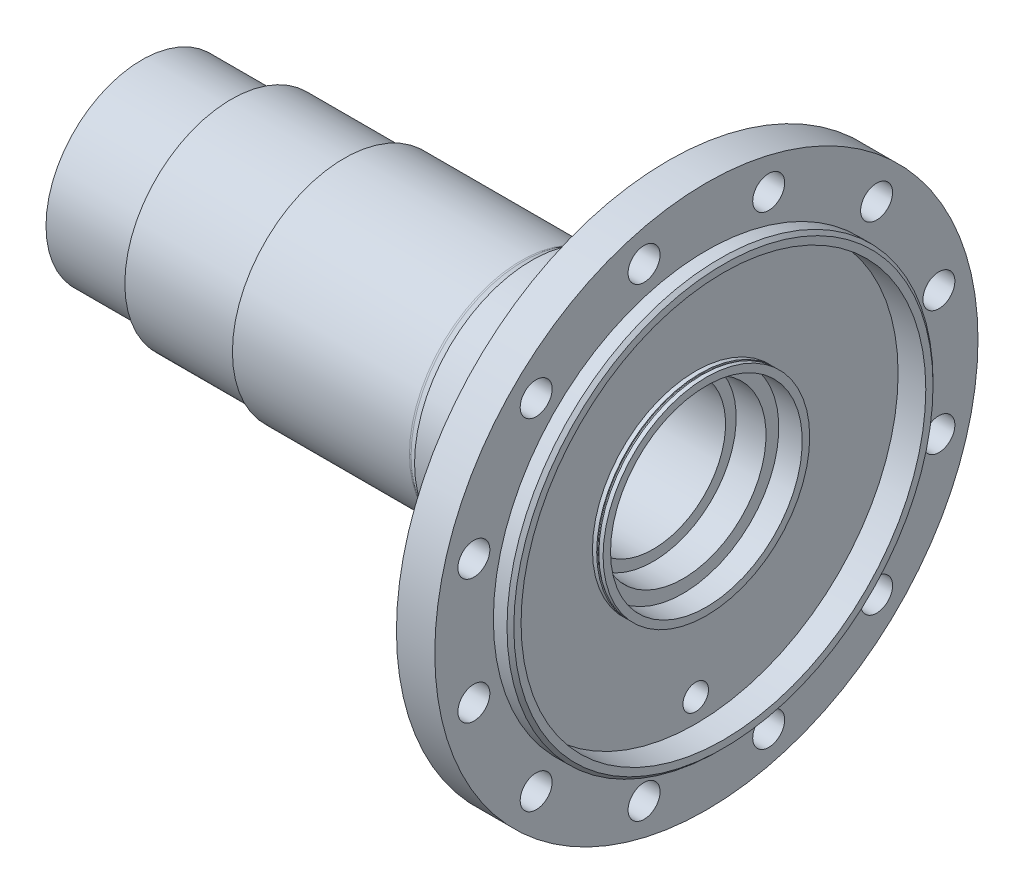
from build123d import *

# Parameters (mm, degrees)
SKETCH_3_W           = 2
SKETCH_3_H           = 46.5
SKETCH_5_W           = 2
SKETCH_5_H           = 46.5
SKETCH_6_R           = 7.5
CUT_EXTRUDE_1_DEPTH  = 328.171973127
SKETCH_7_R           = 7.5
CUT_EXTRUDE_2_DEPTH  = 328.171973127
SKETCH_8_R           = 7.5
CUT_EXTRUDE_3_DEPTH  = 328.171973127
SKETCH_9_R           = 7.5
CUT_EXTRUDE_4_DEPTH  = 328.171973127
SKETCH_10_R          = 7.5
CUT_EXTRUDE_5_DEPTH  = 328.171973127
SKETCH_11_R          = 7.5
CUT_EXTRUDE_6_DEPTH  = 328.171973127
SKETCH_12_R          = 7.5
CUT_EXTRUDE_7_DEPTH  = 328.171973127
SKETCH_13_R          = 7.5
CUT_EXTRUDE_8_DEPTH  = 328.171973127
SKETCH_14_R          = 7.5
CUT_EXTRUDE_9_DEPTH  = 328.171973127
SKETCH_15_R          = 7.5
CUT_EXTRUDE_10_DEPTH = 328.171973127
SKETCH_16_R          = 7.5
CUT_EXTRUDE_11_DEPTH = 328.171973127
SKETCH_17_R          = 7.5
CUT_EXTRUDE_12_DEPTH = 328.171973127
SKETCH_18_R          = 6
CUT_EXTRUDE_13_DEPTH = 328.171973127


with BuildPart() as part:
    # Эскиз1 → Повернуть1 (revolve)
    with BuildSketch(Plane.XY, mode=Mode.PRIVATE) as revolve_1_sk:
        with BuildLine():
            Line((0, 0), (273, 0))
            Line((273, 0), (273, 98.4))
            Line((273, 98.4), (271.4, 100))
            Line((271.4, 100), (265, 100))
            Line((265, 100), (265, 127.5))
            Line((265, 127.5), (247, 127.5))
            Line((247, 127.5), (247, 94.828427125))
            ThreePointArc((247, 94.828427125), (246.847759065, 94.06306026), (246.414213562, 93.414213562))
            Line((246.414213562, 93.414213562), (245, 92))
            Line((245, 92), (245, 82.828427125))
            ThreePointArc((245, 82.828427125), (244.847759065, 82.06306026), (244.414213562, 81.414213562))
            Line((244.414213562, 81.414213562), (241, 78))
            Line((241, 78), (241, 68.328427125))
            ThreePointArc((241, 68.328427125), (240.847759065, 67.56306026), (240.414213562, 66.914213562))
            Line((240.414213562, 66.914213562), (239, 65.5))
            Line((239, 65.5), (239, 64.5))
            ThreePointArc((239, 64.5), (238.414213562, 63.085786438), (237, 62.5))
            Line((237, 62.5), (218, 62.5))
            Line((218, 62.5), (215, 60.767949192))
            Line((215, 60.767949192), (215, 57))
            ThreePointArc((215, 57), (214.414213562, 55.585786438), (213, 55))
            Line((213, 55), (183, 55))
            Line((183, 55), (179.133974596, 52.767949192))
            ThreePointArc((179.133974596, 52.767949192), (178.651612686, 52.568148347), (178.133974596, 52.5))
            Line((178.133974596, 52.5), (95, 52.5))
            Line((95, 52.5), (95, 50))
            Line((95, 50), (42, 50))
            Line((42, 50), (42, 45))
            Line((42, 45), (0, 45))
            Line((0, 45), (0, 0))
        make_face()
    revolve(revolve_1_sk.sketch.rotate(Axis((0, 0, 0), (1, 0, 0)), 90), axis=Axis((0, 0, 0), (1, 0, 0)))

    # Эскиз2 → Вырез-Повернуть1 (revolve, cut)
    with BuildSketch(Plane.XY, mode=Mode.PRIVATE) as cut_revolve_1_sk:
        Polygon((0, 0), (273, 0), (273, 95), (265, 95), (265, 45), (254, 45), (254, 39), (240, 39), (240, 34), (203.5, 34), (203.5, 31), (3, 31), (0, 32.732050808), align=None)
    revolve(cut_revolve_1_sk.sketch.rotate(Axis((0, 0, 0), (1, 0, 0)), 90), axis=Axis((0, 0, 0), (1, 0, 0)), mode=Mode.SUBTRACT)

    # Эскиз3 → Rear_recess_left (revolve, cut)
    with BuildSketch(Plane.XY, mode=Mode.PRIVATE) as rear_recess_left_sk:
        with Locations((261, 71.75)):
            Rectangle(SKETCH_3_W, SKETCH_3_H)
    revolve(rear_recess_left_sk.sketch.rotate(Axis((0, 0, 0), (1, 0, 0)), 90), axis=Axis((0, 0, 0), (1, 0, 0)), mode=Mode.SUBTRACT)

    # Эскиз4 → Collar_groove_nominal (revolve, cut)
    with BuildSketch(Plane.XY, mode=Mode.PRIVATE) as collar_groove_nominal_sk:
        with BuildLine():
            Line((263, 48), (263, 95))
            Line((263, 95), (262, 95))
            Line((262, 95), (262, 48))
            ThreePointArc((262, 48), (262.146446609, 47.646446609), (262.5, 47.5))
            ThreePointArc((262.5, 47.5), (262.853553391, 47.646446609), (263, 48))
        make_face()
    revolve(collar_groove_nominal_sk.sketch.rotate(Axis((0, 0, 0), (1, 0, 0)), 90), axis=Axis((0, 0, 0), (1, 0, 0)), mode=Mode.SUBTRACT)

    # Эскиз5 → Rear_recess_lip (revolve, cut)
    with BuildSketch(Plane.XY, mode=Mode.PRIVATE) as rear_recess_lip_sk:
        with Locations((264, 71.75)):
            Rectangle(SKETCH_5_W, SKETCH_5_H)
    revolve(rear_recess_lip_sk.sketch.rotate(Axis((0, 0, 0), (1, 0, 0)), 90), axis=Axis((0, 0, 0), (1, 0, 0)), mode=Mode.SUBTRACT)

    # Эскиз6 → Вырез-Вытянуть1 (cut, through all)
    with BuildSketch(Plane(origin=(0, 0, 0), x_dir=(0, 0, -1), z_dir=(1, 0, 0))):
        with Locations(Location((109.149618371, 29.246552097, 0), (0, 0, 180))):
            Circle(SKETCH_6_R)
    extrude(amount=CUT_EXTRUDE_1_DEPTH, mode=Mode.SUBTRACT)

    # Эскиз7 → Вырез-Вытянуть2 (cut, through all)
    with BuildSketch(Plane(origin=(0, 0, 0), x_dir=(0, 0, -1), z_dir=(1, 0, 0))):
        with Locations(Location((79.903066274, 79.903066274, 0), (0, 0, 180))):
            Circle(SKETCH_7_R)
    extrude(amount=CUT_EXTRUDE_2_DEPTH, mode=Mode.SUBTRACT)

    # Эскиз8 → Вырез-Вытянуть3 (cut, through all)
    with BuildSketch(Plane(origin=(0, 0, 0), x_dir=(0, 0, -1), z_dir=(1, 0, 0))):
        with Locations(Location((29.246552097, 109.149618371, 0), (0, 0, 180))):
            Circle(SKETCH_8_R)
    extrude(amount=CUT_EXTRUDE_3_DEPTH, mode=Mode.SUBTRACT)

    # Эскиз9 → Вырез-Вытянуть4 (cut, through all)
    with BuildSketch(Plane(origin=(0, 0, 0), x_dir=(0, 0, -1), z_dir=(1, 0, 0))):
        with Locations(Location((-29.246552097, 109.149618371, 0), (0, 0, 180))):
            Circle(SKETCH_9_R)
    extrude(amount=CUT_EXTRUDE_4_DEPTH, mode=Mode.SUBTRACT)

    # Эскиз10 → Вырез-Вытянуть5 (cut, through all)
    with BuildSketch(Plane(origin=(0, 0, 0), x_dir=(0, 0, -1), z_dir=(1, 0, 0))):
        with Locations(Location((-79.903066274, 79.903066274, 0), (0, 0, 180))):
            Circle(SKETCH_10_R)
    extrude(amount=CUT_EXTRUDE_5_DEPTH, mode=Mode.SUBTRACT)

    # Эскиз11 → Вырез-Вытянуть6 (cut, through all)
    with BuildSketch(Plane(origin=(0, 0, 0), x_dir=(0, 0, -1), z_dir=(1, 0, 0))):
        with Locations(Location((-109.149618371, 29.246552097, 0), (0, 0, 180))):
            Circle(SKETCH_11_R)
    extrude(amount=CUT_EXTRUDE_6_DEPTH, mode=Mode.SUBTRACT)

    # Эскиз12 → Вырез-Вытянуть7 (cut, through all)
    with BuildSketch(Plane(origin=(0, 0, 0), x_dir=(0, 0, -1), z_dir=(1, 0, 0))):
        with Locations(Location((-109.149618371, -29.246552097, 0), (0, 0, 180))):
            Circle(SKETCH_12_R)
    extrude(amount=CUT_EXTRUDE_7_DEPTH, mode=Mode.SUBTRACT)

    # Эскиз13 → Вырез-Вытянуть8 (cut, through all)
    with BuildSketch(Plane(origin=(0, 0, 0), x_dir=(0, 0, -1), z_dir=(1, 0, 0))):
        with Locations(Location((-79.903066274, -79.903066274, 0), (0, 0, 180))):
            Circle(SKETCH_13_R)
    extrude(amount=CUT_EXTRUDE_8_DEPTH, mode=Mode.SUBTRACT)

    # Эскиз14 → Вырез-Вытянуть9 (cut, through all)
    with BuildSketch(Plane(origin=(0, 0, 0), x_dir=(0, 0, -1), z_dir=(1, 0, 0))):
        with Locations(Location((-29.246552097, -109.149618371, 0), (0, 0, 180))):
            Circle(SKETCH_14_R)
    extrude(amount=CUT_EXTRUDE_9_DEPTH, mode=Mode.SUBTRACT)

    # Эскиз15 → Вырез-Вытянуть10 (cut, through all)
    with BuildSketch(Plane(origin=(0, 0, 0), x_dir=(0, 0, -1), z_dir=(1, 0, 0))):
        with Locations(Location((29.246552097, -109.149618371, 0), (0, 0, 180))):
            Circle(SKETCH_15_R)
    extrude(amount=CUT_EXTRUDE_10_DEPTH, mode=Mode.SUBTRACT)

    # Эскиз16 → Вырез-Вытянуть11 (cut, through all)
    with BuildSketch(Plane(origin=(0, 0, 0), x_dir=(0, 0, -1), z_dir=(1, 0, 0))):
        with Locations(Location((79.903066274, -79.903066274, 0), (0, 0, 180))):
            Circle(SKETCH_16_R)
    extrude(amount=CUT_EXTRUDE_11_DEPTH, mode=Mode.SUBTRACT)

    # Эскиз17 → Вырез-Вытянуть12 (cut, through all)
    with BuildSketch(Plane(origin=(0, 0, 0), x_dir=(0, 0, -1), z_dir=(1, 0, 0))):
        with Locations(Location((109.149618371, -29.246552097, 0), (0, 0, 180))):
            Circle(SKETCH_17_R)
    extrude(amount=CUT_EXTRUDE_12_DEPTH, mode=Mode.SUBTRACT)

    # Эскиз18 → Вырез-Вытянуть13 (cut, through all)
    with BuildSketch(Plane(origin=(0, 0, 0), x_dir=(0, 0, -1), z_dir=(1, 0, 0))):
        with Locations(Location((0, -84, 0), (0, 0, 166.725608927))):
            Circle(SKETCH_18_R)
    extrude(amount=CUT_EXTRUDE_13_DEPTH, mode=Mode.SUBTRACT)


solid = part.part
